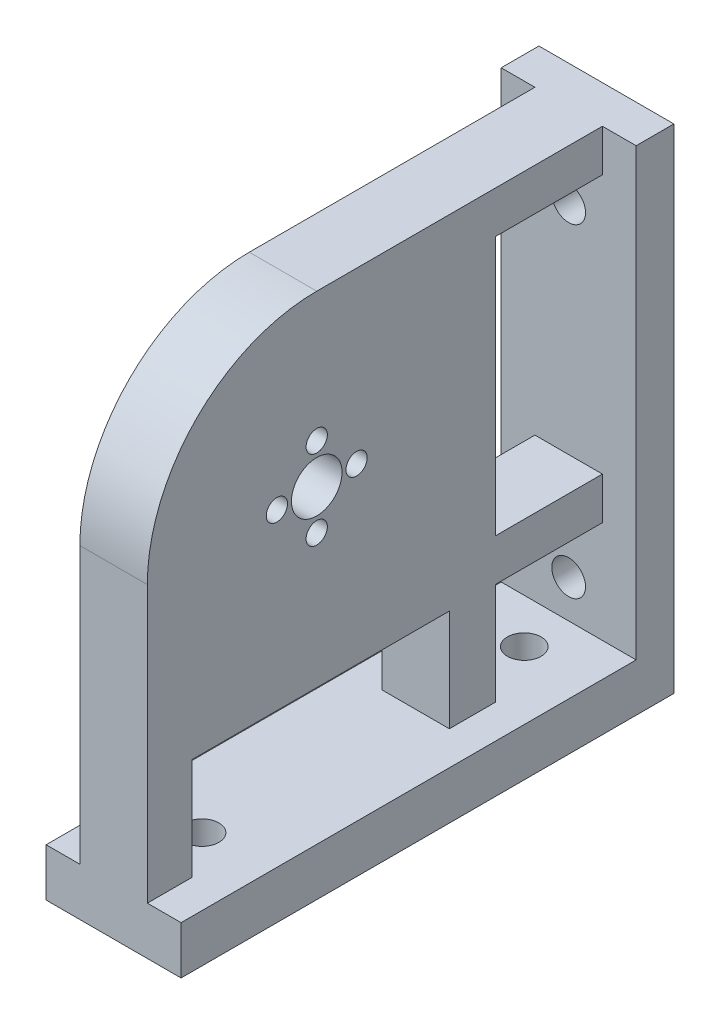
from build123d import *

# Parameters (mm, degrees)
SKETCH1_R                = 4.7625
BOSS_EXTRUDE1_DEPTH      = 12.7
BOSS_EXTRUDE2_DEPTH      = 6.35
BOSS_EXTRUDE2_DEPTH_BACK = 19.05
SKETCH4_W                = 20.078494948
SKETCH4_H                = 48.78095735
SKETCH4_W_2              = 48.420880553
SKETCH4_H_2              = 19.195923741
CUT_EXTRUDE2_DEPTH       = 26.162
SKETCH5_R                = 3.175
CUT_EXTRUDE3_DEPTH       = 11.43
SKETCH6_R                = 3.175
CUT_EXTRUDE4_DEPTH       = 11.43
SKETCH11_R               = 2
CUT_EXTRUDE7_DEPTH       = 21.844


with BuildPart() as part:
    # Sketch1 → Boss-Extrude1 (new body)
    with BuildSketch(Plane(origin=(0, 0, 0), x_dir=(0, 0, -1), z_dir=(1, 0, 0))):
        with BuildLine():
            Line((0, 31.882172919), (31.882172919, 31.882172919))
            Line((31.882172919, 31.882172919), (60.87463474, 31.882172919))
            Line((60.87463474, 31.882172919), (60.87463474, -60.96))
            Line((60.87463474, -60.96), (-31.882172919, -60.96))
            Line((-31.882172919, -60.96), (-31.882172919, 0))
            ThreePointArc((-31.882172919, 0), (-22.54410067, 22.54410067), (0, 31.882172919))
        make_face()
        Circle(SKETCH1_R, mode=Mode.SUBTRACT)
    extrude(amount=BOSS_EXTRUDE1_DEPTH)

    # Sketch8 → Boss-Extrude2 (add, two sides: drawn at the far end of the back side and taken through both)
    with BuildSketch(Plane(origin=(12.7, 0, 0), x_dir=(0, 0, -1), z_dir=(1, 0, 0)).offset(-BOSS_EXTRUDE2_DEPTH_BACK)):
        Polygon((60.87463474, 31.882172919), (53.770648903, 31.882172919), (53.770648903, -51.937867719), (-31.882172919, -51.937867719), (-31.882172919, -60.96), (53.770648903, -60.96), (60.87463474, -60.96), align=None)
    extrude(amount=BOSS_EXTRUDE2_DEPTH + BOSS_EXTRUDE2_DEPTH_BACK)

    # Sketch4 → Cut-Extrude2 (cut)
    with BuildSketch(Plane.ZY):
        with Locations((-43.731401429, -0.427222634)):
            Rectangle(SKETCH4_W, SKETCH4_H)
        with Locations((-0.75610861, -42.339905849)):
            Rectangle(SKETCH4_W_2, SKETCH4_H_2)
        with Locations((-43.731401429, -42.339905849)):
            Rectangle(SKETCH4_W, SKETCH4_H_2)
    extrude(amount=-CUT_EXTRUDE2_DEPTH, mode=Mode.SUBTRACT)

    # Sketch5 → Cut-Extrude3 (cut)
    with BuildSketch(Plane(origin=(0, 0, -60.87463474), x_dir=(-1, 0, 0), z_dir=(0, 0, -1))):
        with Locations((-6.35, 16.187024645)):
            Circle(SKETCH5_R)
        with Locations((-6.35, -44.788648077)):
            Circle(SKETCH5_R)
    extrude(amount=-CUT_EXTRUDE3_DEPTH, mode=Mode.SUBTRACT)

    # Sketch6 → Cut-Extrude4 (cut)
    with BuildSketch(Plane.XZ.offset(60.96)):
        with Locations((6.35, 15.24)):
            Circle(SKETCH6_R)
        with Locations((6.35, -45.41055385)):
            Circle(SKETCH6_R)
    extrude(amount=-CUT_EXTRUDE4_DEPTH, mode=Mode.SUBTRACT)

    # Sketch11 → Cut-Extrude7 (cut)
    with BuildSketch(Plane(origin=(12.7, 0, 0), x_dir=(0, 0, -1), z_dir=(1, 0, 0))):
        with Locations((7.5, 0)):
            Circle(SKETCH11_R)
        with Locations((0, -7.5)):
            Circle(SKETCH11_R)
        with Locations((-7.5, 0)):
            Circle(SKETCH11_R)
        with Locations((0, 7.5)):
            Circle(SKETCH11_R)
    extrude(amount=-CUT_EXTRUDE7_DEPTH, mode=Mode.SUBTRACT)


solid = part.part
